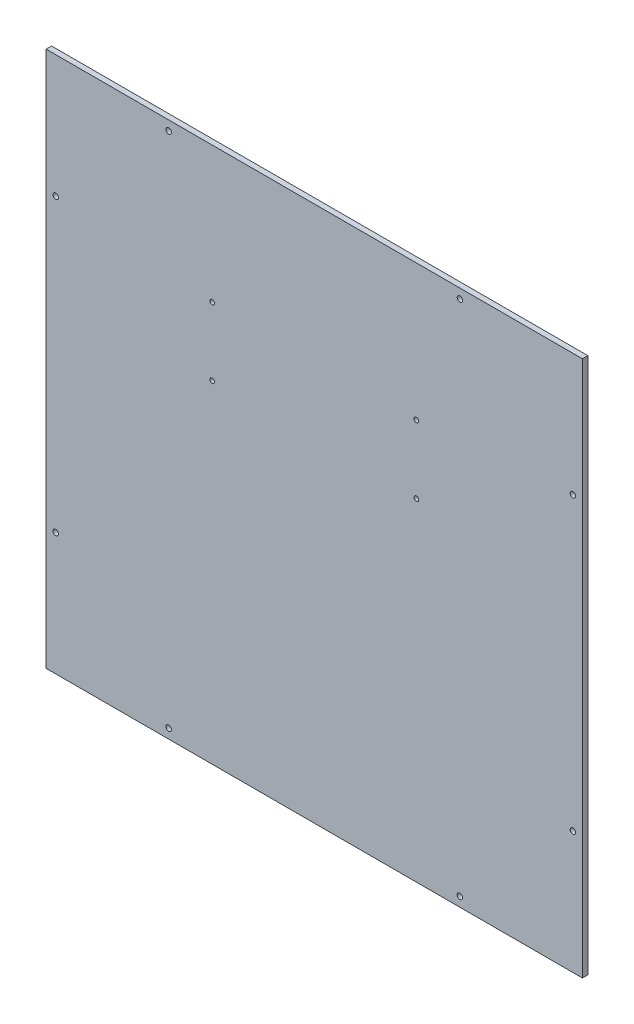
from build123d import *

# Parameters (mm, degrees)
SCHIZZO1_W                   = 394
SCHIZZO1_H                   = 394
SCHIZZO1_R                   = 2
ESTRUSIONE_ESTRUSIONE1_DEPTH = 4
SCHIZZO2_R                   = 1.7
TAGLIO_ESTRUSIONE1_DEPTH     = 558.214500888


with BuildPart() as part:
    # Schizzo1 → Estrusione-Estrusione1 (new body)
    with BuildSketch(Plane.XY):
        with Locations((197, 197)):
            Rectangle(SCHIZZO1_W, SCHIZZO1_H)
        with Locations((90, 387)):
            Circle(SCHIZZO1_R, mode=Mode.SUBTRACT)
        with Locations(Location((304, 387, 0), (0, 0, 180))):
            Circle(SCHIZZO1_R, mode=Mode.SUBTRACT)
        with Locations((387, 304)):
            Circle(SCHIZZO1_R, mode=Mode.SUBTRACT)
        with Locations(Location((7, 304, 0), (0, 0, 180))):
            Circle(SCHIZZO1_R, mode=Mode.SUBTRACT)
        with Locations(Location((387, 90, 0), (0, 0, 180))):
            Circle(SCHIZZO1_R, mode=Mode.SUBTRACT)
        with Locations((304, 7)):
            Circle(SCHIZZO1_R, mode=Mode.SUBTRACT)
        with Locations(Location((90, 7, 0), (0, 0, 180))):
            Circle(SCHIZZO1_R, mode=Mode.SUBTRACT)
        with Locations((7, 90)):
            Circle(SCHIZZO1_R, mode=Mode.SUBTRACT)
    extrude(amount=ESTRUSIONE_ESTRUSIONE1_DEPTH)

    # Schizzo2 → Taglio-Estrusione1 (cut, through all)
    with BuildSketch(Plane.XY.offset(4)):
        with Locations((122, 294)):
            Circle(SCHIZZO2_R)
        with Locations((122, 244)):
            Circle(SCHIZZO2_R)
        with Locations((272, 294)):
            Circle(SCHIZZO2_R)
        with Locations((272, 244)):
            Circle(SCHIZZO2_R)
    extrude(amount=-TAGLIO_ESTRUSIONE1_DEPTH, mode=Mode.SUBTRACT)


solid = part.part
